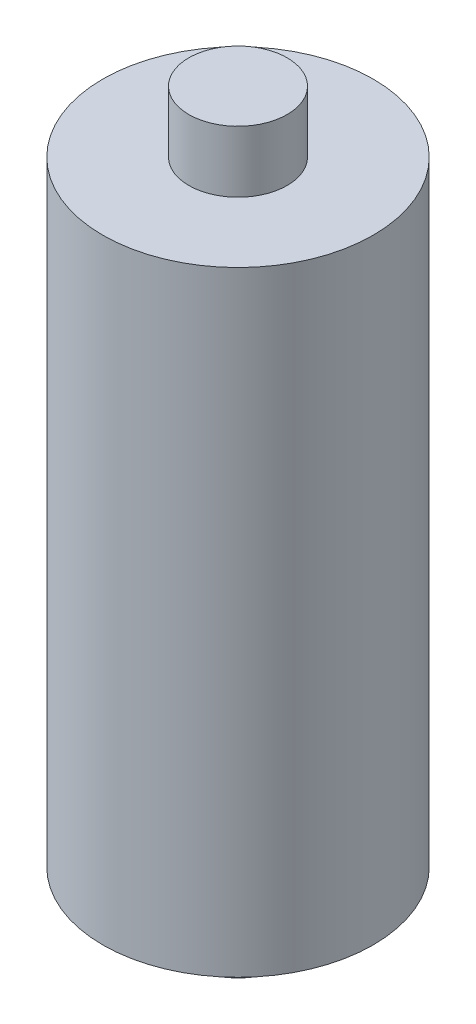
from build123d import *

# Parameters (mm, degrees)
SKETCH_1_R      = 11
EXTRUDE_1_DEPTH = 25
SKETCH_2_R      = 4
EXTRUDE_2_DEPTH = 5


with BuildPart() as part:
    # 草图1 → 凸台-拉伸1 (new, symmetric)
    with BuildSketch(Plane(origin=(0, 0, 0), x_dir=(1, 0, 0), z_dir=(0, 1, 0))):
        with Locations(Location((0, 0, 0), (0, 0, 270))):
            Circle(SKETCH_1_R)
    extrude(amount=EXTRUDE_1_DEPTH, both=True)

    # 草图2 → 凸台-拉伸2 (add)
    with BuildSketch(Plane(origin=(0, 25, 0), x_dir=(1, 0, 0), z_dir=(0, 1, 0))):
        with Locations(Location((0, 0, 0), (0, 0, 270))):
            Circle(SKETCH_2_R)
    extrude_2 = extrude(amount=EXTRUDE_2_DEPTH)

    # 镜向1: 凸台-拉伸2 across plane
    add(extrude_2.mirror(Plane.ZX))


solid = part.part
